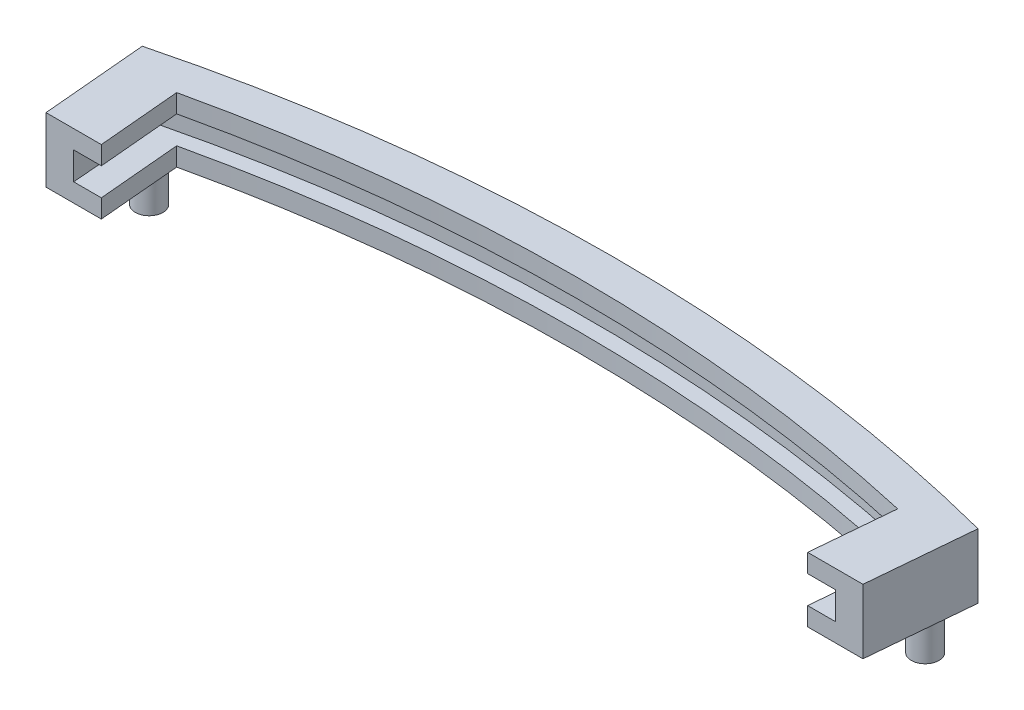
from build123d import *

# Parameters (mm, degrees)
BOSS_EXTRUDE4_DEPTH = 2
BOSS_EXTRUDE5_DEPTH = 3
BOSS_EXTRUDE6_DEPTH = 2
SKETCH7_R           = 1.5
BOSS_EXTRUDE7_DEPTH = 5


with BuildPart() as part:
    # Sketch2 → Boss-Extrude4 (new body)
    with BuildSketch(Plane(origin=(0, 0, 0), x_dir=(1, 0, 0), z_dir=(0, 1, 0))):
        with BuildLine():
            Line((-44.292533925, 163.999092012), (-38.292533925, 163.999092012))
            Line((-38.292533925, 163.999092012), (-39.089453392, 172.963740324))
            ThreePointArc((-39.089453392, 172.963740324), (0, 177.325804195), (39.089453392, 172.963740324))
            Line((39.089453392, 172.963740324), (38.292533925, 163.999092012))
            Line((38.292533925, 163.999092012), (44.292533925, 163.999092012))
            Line((44.292533925, 163.999092012), (45.310819911, 175.453920411))
            ThreePointArc((45.310819911, 175.453920411), (0, 181.210233123), (-45.310819911, 175.453920411))
            Line((-45.310819911, 175.453920411), (-44.292533925, 163.999092012))
        make_face()
    extrude(amount=BOSS_EXTRUDE4_DEPTH)

    # Sketch5 → Boss-Extrude5 (add)
    with BuildSketch(Plane(origin=(0, 2, 0), x_dir=(1, 0, 0), z_dir=(0, 1, 0))):
        with BuildLine():
            Line((-41.292533925, 163.999092012), (-42.102735456, 173.978043635))
            ThreePointArc((-42.102735456, 173.978043635), (0.038720573, 178.999995812), (42.178, 173.959812359))
            Line((42.178, 173.959812359), (41.292533925, 163.999092012))
            Line((41.292533925, 163.999092012), (44.292533925, 163.999092012))
            Line((44.292533925, 163.999092012), (45.310819911, 175.453920411))
            ThreePointArc((45.310819911, 175.453920411), (0, 181.210233123), (-45.310819911, 175.453920411))
            Line((-45.310819911, 175.453920411), (-44.292533925, 163.999092012))
            Line((-44.292533925, 163.999092012), (-41.292533925, 163.999092012))
        make_face()
    extrude(amount=BOSS_EXTRUDE5_DEPTH)

    # Sketch6 → Boss-Extrude6 (add)
    with BuildSketch(Plane(origin=(0, 5, 0), x_dir=(1, 0, 0), z_dir=(0, 1, 0))):
        with BuildLine():
            Line((-44.292533925, 163.999092012), (-38.292533925, 163.999092012))
            Line((-38.292533925, 163.999092012), (-39.089453392, 172.963740324))
            ThreePointArc((-39.089453392, 172.963740324), (0, 177.325804195), (39.089453392, 172.963740324))
            Line((39.089453392, 172.963740324), (38.292533925, 163.999092012))
            Line((38.292533925, 163.999092012), (44.292533925, 163.999092012))
            Line((44.292533925, 163.999092012), (45.310819911, 175.453920411))
            ThreePointArc((45.310819911, 175.453920411), (0, 181.210233123), (-45.310819911, 175.453920411))
            Line((-45.310819911, 175.453920411), (-44.292533925, 163.999092012))
        make_face()
    extrude(amount=BOSS_EXTRUDE6_DEPTH)

    # Sketch7 → Boss-Extrude7 (add)
    with BuildSketch(Plane.XZ):
        with Locations(Location((-42.072341363, -172.963740324, 0), (0, 0, 90))):
            Circle(SKETCH7_R)
        with Locations(Location((42.072341363, -172.963740324, 0), (0, 0, 90))):
            Circle(SKETCH7_R)
    extrude(amount=BOSS_EXTRUDE7_DEPTH)


solid = part.part
